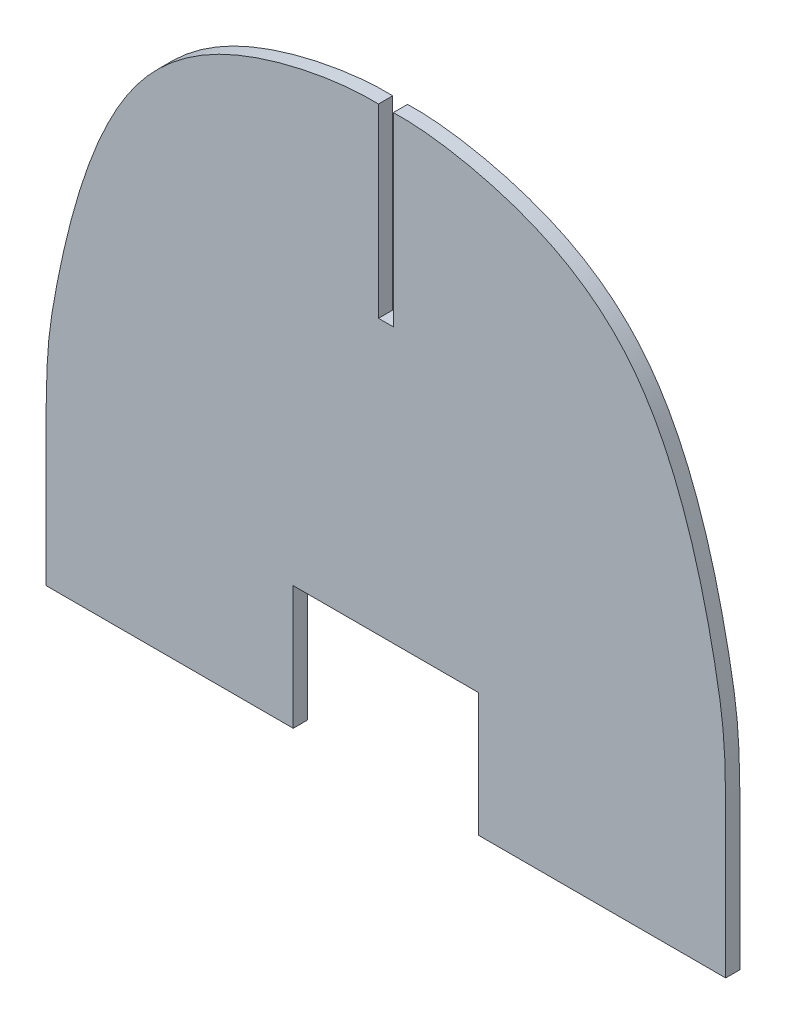
from build123d import *

# Parameters (mm, degrees)
BOSS_EXTRUDE1_DEPTH = 5.842
SKETCH3_W           = 38.1
SKETCH3_H           = 50.8
CUT_EXTRUDE1_DEPTH  = 313.597261712


with BuildPart() as part:
    # Sketch2 → Boss-Extrude1 (new body)
    with BuildSketch(Plane.XY):
        with BuildLine():
            Line((139.7, 39.6875), (0, 39.6875))
            Line((0, 39.6875), (0, 279.4))
            add(Edge.make_bspline(
                [(0, 279.4), (0.899505202, 279.4), (16.492381926, 280.353025588), (63.371494318, 272.22775417), (117.029317673, 231.616459975), (141.431993663, 126.233406498), (139.7, 115.50324322), (139.7, 39.6875)],
                knots=[0, 0, 0, 0, 0.009736034, 0.194720679, 0.367314873, 0.657046702, 1, 1, 1, 1], degree=3))
        make_face()
    extrude(amount=BOSS_EXTRUDE1_DEPTH)

    # Sketch3 → Cut-Extrude1 (cut, through all)
    with BuildSketch(Plane.XY.offset(5.842)):
        Polygon((0, 279.4), (0, 282.23249209), (3.048, 282.23249209), (3.048, 203.2), (0, 203.2), align=None)
        with Locations((19.05, 65.0875)):
            Rectangle(SKETCH3_W, SKETCH3_H)
    extrude(amount=-CUT_EXTRUDE1_DEPTH, mode=Mode.SUBTRACT)

    # Mirror1: part across plane


with BuildPart() as part_1:
    add(part.part)
    add(part.part.mirror(Plane(origin=(0, 0, 0), x_dir=(0, 0, 1), z_dir=(1, 0, 0))))


solid = part_1.part
